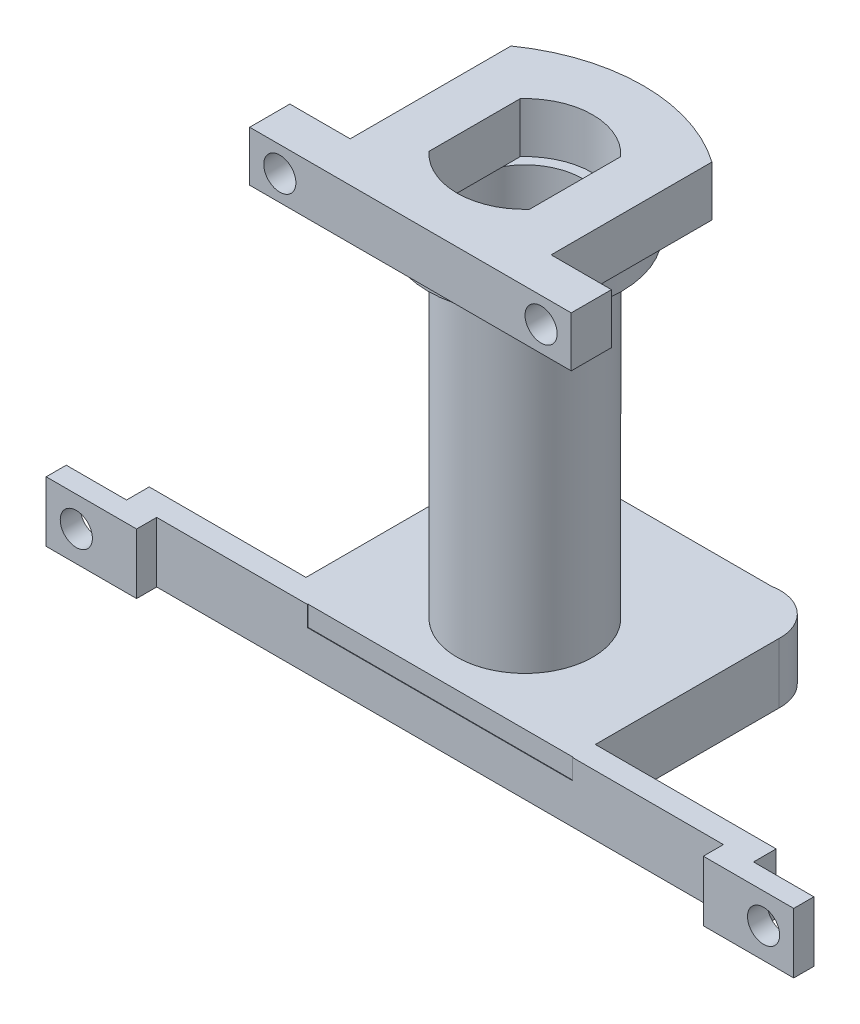
from build123d import *

# Parameters (mm, degrees)
SKETCH1_W            = 6
SKETCH1_H            = 4
BOSS_EXTRUDE1_DEPTH  = 5
SKETCH2_R            = 1.6
CUT_EXTRUDE1_DEPTH   = 5
SKETCH4_R            = 9.654229578
SKETCH4_R_2          = 6.752232565
BOSS_EXTRUDE3_DEPTH  = 7
SKETCH5_R            = 6.752232565
SKETCH5_R_2          = 5.75
BOSS_EXTRUDE4_DEPTH  = 35
BOSS_EXTRUDE5_DEPTH  = 6
SKETCH9_R            = 6.752232565
BOSS_EXTRUDE7_DEPTH  = 2
BOSS_EXTRUDE8_DEPTH  = 2
SKETCH11_W           = 26.4
SKETCH11_H           = 2
BOSS_EXTRUDE9_DEPTH  = 2.2
BOSS_EXTRUDE10_DEPTH = 4
SKETCH13_W           = 2
SKETCH13_H           = 6
BOSS_EXTRUDE11_DEPTH = 2
SKETCH14_W           = 2
SKETCH14_H           = 6
BOSS_EXTRUDE12_DEPTH = 2
SKETCH15_R           = 1.6
CUT_EXTRUDE2_DEPTH   = 2


with BuildPart() as part:
    # Sketch1 → Boss-Extrude1 (new body)
    # profile 1 of 3: a face of its own
    with BuildSketch(Plane(origin=(0, 0, 0), x_dir=(1, 0, 0), z_dir=(0, 1, 0))):
        with BuildLine():
            ThreePointArc((0, 20), (10, 23.172897988), (20, 20))
            Line((20, 20), (20, 0))
            Line((20, 0), (0, 0))
            Line((0, 0), (0, 20))
        make_face()
        with BuildLine():
            Line((5, 18.894117647), (5, 4))
            Line((5, 4), (15, 4))
            Line((15, 4), (15, 18.776470588))
            ThreePointArc((15, 18.776470588), (10.011911878, 19.847803762), (5, 18.894117647))
        make_face(mode=Mode.SUBTRACT)
    # profile 2 of 3: a face of its own
    with BuildSketch(Plane(origin=(0, 0, 0), x_dir=(1, 0, 0), z_dir=(0, 1, 0))):
        with Locations((-3, 2)):
            Rectangle(SKETCH1_W, SKETCH1_H)
    # profile 3 of 3: a face of its own
    with BuildSketch(Plane(origin=(0, 0, 0), x_dir=(1, 0, 0), z_dir=(0, 1, 0))):
        with Locations((23, 2)):
            Rectangle(SKETCH1_W, SKETCH1_H)
    extrude(amount=BOSS_EXTRUDE1_DEPTH)

    # Sketch2 → Cut-Extrude1 (cut)
    with BuildSketch(Plane(origin=(0, 0, -4), x_dir=(-1, 0, 0), z_dir=(0, 0, -1))):
        with Locations((3, 2.5)):
            Circle(SKETCH2_R)
        with Locations((-23, 2.5)):
            Circle(SKETCH2_R)
    extrude(amount=-CUT_EXTRUDE1_DEPTH, mode=Mode.SUBTRACT)

    # Sketch4 → Boss-Extrude3 (add)
    with BuildSketch(Plane(origin=(0, 5, 0), x_dir=(1, 0, 0), z_dir=(0, 1, 0))):
        with Locations(Location((10, 11.388235294, 0), (0, 0, 270))):
            Circle(SKETCH4_R)
        with Locations(Location((10, 11.388235294, 0), (0, 0, 270))):
            Circle(SKETCH4_R_2, mode=Mode.SUBTRACT)
    extrude(amount=-BOSS_EXTRUDE3_DEPTH)

    # Sketch5 → Boss-Extrude4 (add)
    with BuildSketch(Plane.XZ):
        with Locations(Location((10, -11.388235294, 0), (0, 0, 90))):
            Circle(SKETCH5_R)
        with Locations(Location((10, -11.388235294, 0), (0, 0, 150.408154206))):
            Circle(SKETCH5_R_2, mode=Mode.SUBTRACT)
    extrude(amount=BOSS_EXTRUDE4_DEPTH)


with BuildPart() as body_2:
    # Sketch7 → Boss-Extrude5 (new body)
    with BuildSketch(Plane.XZ.offset(35)):
        with BuildLine():
            ThreePointArc((-0.268165216, -26.4), (-3.233175608, -25.242402121), (-4.4, -22.281010504))
            Line((-4.4, -22.281010504), (-4.4, -4))
            Line((-4.4, -4), (-2, -4))
            Line((-2, -4), (-2, -22.281010504))
            ThreePointArc((-2, -22.281010504), (-1.356014381, -23.554718814), (0, -24))
            Line((0, -24), (19.818955029, -24))
            ThreePointArc((19.818955029, -24), (21.265491896, -23.592214456), (22, -22.281010504))
            Line((22, -22.281010504), (22, -4))
            Line((22, -4), (24.4, -4))
            Line((24.4, -4), (24.4, -22.281010504))
            ThreePointArc((24.4, -22.281010504), (22.970853326, -25.512440046), (19.550789813, -26.4))
            Line((19.550789813, -26.4), (-0.268165216, -26.4))
        make_face()
    extrude(amount=BOSS_EXTRUDE5_DEPTH)

    # Sketch9 → Boss-Extrude7 (add)
    with BuildSketch(Plane.XZ.offset(35)):
        with BuildLine():
            Line((24.4, -22.281010504), (24.4, -4))
            Line((24.4, -4), (-4.4, -4))
            Line((-4.4, -4), (-4.4, -22.569632221))
            ThreePointArc((-4.4, -22.569632221), (-3.241933512, -25.233644217), (-0.581540291, -26.4))
            Line((-0.581540291, -26.4), (-0.268165216, -26.4))
            Line((-0.268165216, -26.4), (19.550789813, -26.4))
            Line((19.550789813, -26.4), (21.134588718, -26.4))
            ThreePointArc((21.134588718, -26.4), (23.436778227, -25.046515144), (24.4, -22.555691665))
            Line((24.4, -22.555691665), (24.4, -22.281010504))
        make_face()
        with Locations(Location((10, -11.388235294, 0), (0, 0, 270))):
            Circle(SKETCH9_R, mode=Mode.SUBTRACT)
    extrude(amount=BOSS_EXTRUDE7_DEPTH)

    # Sketch10 → Boss-Extrude8 (add)
    with BuildSketch(Plane.XZ.offset(37)):
        Polygon((-2, -1.744918399), (-2, -4), (-20, -4), (-20, -1.744918399), (-24, -1.744918399), (-24, 0.255081601), (-17, 0.255081601), (-17, -1.744918399), align=None)
        Polygon((42.395891067, -1.744918399), (42.395891067, -4), (24.4, -4), (24.4, -1.744918399), (39.4, -1.744918399), (39.4, 0.255081601), (46.4, 0.255081601), (46.4, -1.744918399), align=None)
    extrude(amount=-BOSS_EXTRUDE8_DEPTH)


with BuildPart() as boss_extrude8_piece_1:
    # of the separate pieces the step leaves, piece 1, a body of its own (boss_extrude8_pieces)
    add(body_2.part.solids().sort_by_distance((-2, -35, -4))[0])



with BuildPart() as boss_extrude8_piece_2:
    # of the separate pieces the step leaves, piece 2, a body of its own (boss_extrude8_pieces)
    add(body_2.part.solids().sort_by_distance((42.395891067, -37, -4))[0])


with BuildPart() as boss_extrude8_piece_1_1:
    add(boss_extrude8_piece_1.part)

    add(boss_extrude8_piece_2.part)  # Boss-Extrude9 merges Boss-Extrude8 piece 2
    # Sketch11 → Boss-Extrude9 (add)
    with BuildSketch(Plane.XY.offset(-4)):
        with Locations((11.2, -36)):
            Rectangle(SKETCH11_W, SKETCH11_H)
    extrude(amount=BOSS_EXTRUDE9_DEPTH)

    # Sketch12 → Boss-Extrude10 (add)
    with BuildSketch(Plane.XZ.offset(37)):
        Polygon((-20, -1.744918399), (-24, -1.744918399), (-24, 0.255081601), (-17, 0.255081601), (-17, -1.744918399), (39.4, -1.744918399), (39.4, 0.255081601), (46.4, 0.255081601), (46.4, -1.744918399), (42.395891067, -1.744918399), (42.395891067, -4), (-20, -4), align=None)
    extrude(amount=BOSS_EXTRUDE10_DEPTH)

    # Sketch13 → Boss-Extrude11 (add)
    with BuildSketch(Plane(origin=(46.4, 0, 0), x_dir=(0, 0, -1), z_dir=(1, 0, 0))):
        with Locations((0.744918399, -38)):
            Rectangle(SKETCH13_W, SKETCH13_H)
    extrude(amount=BOSS_EXTRUDE11_DEPTH)

    # Sketch14 → Boss-Extrude12 (add)
    with BuildSketch(Plane.ZY.offset(24)):
        with Locations((-0.744918399, -38)):
            Rectangle(SKETCH14_W, SKETCH14_H)
    extrude(amount=BOSS_EXTRUDE12_DEPTH)

    # Sketch15 → Cut-Extrude2 (cut)
    with BuildSketch(Plane(origin=(0, 0, -1.744918399), x_dir=(-1, 0, 0), z_dir=(0, 0, -1))):
        with Locations((-45.397945533, -38)):
            Circle(SKETCH15_R)
        with Locations((23, -38)):
            Circle(SKETCH15_R)
    extrude(amount=-CUT_EXTRUDE2_DEPTH, mode=Mode.SUBTRACT)


solid = Compound([part.part, boss_extrude8_piece_1_1.part])
